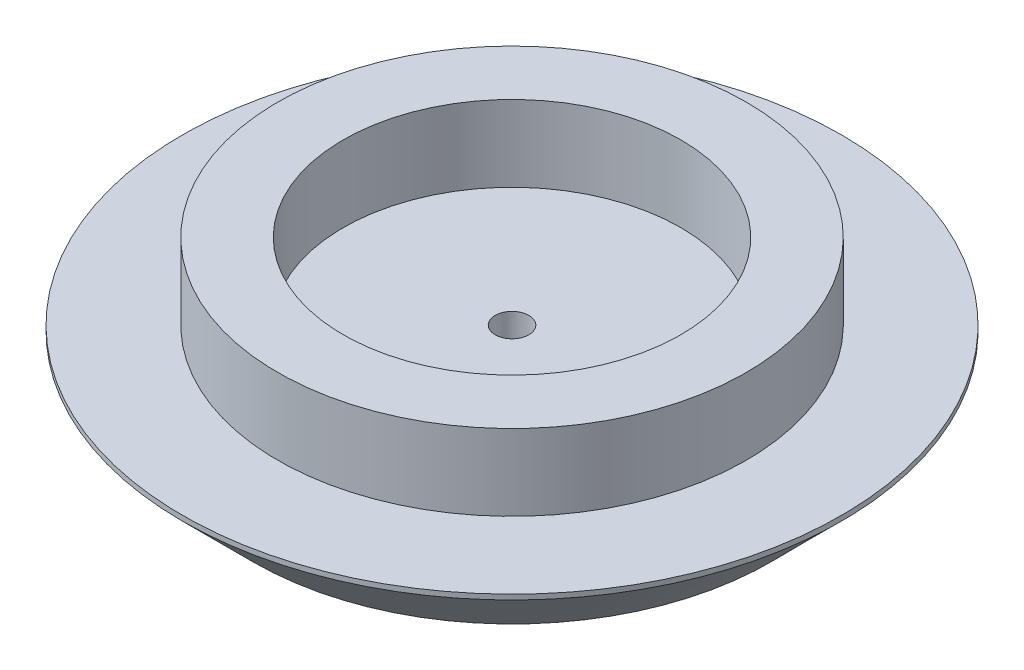
from build123d import *

# Parameters (mm, degrees)
CHAMFER1_SIZE               = 8.89
F_19_0_166_DIAMETER_HOLE1_D = 4.2164


with BuildPart() as part:
    # Sketch1 → Revolve1 (revolve)
    with BuildSketch(Plane.XY, mode=Mode.PRIVATE) as revolve1_sk:
        Polygon((-29.337, 0), (-41.275, 0), (-41.275, -9.525), (0, -9.525), (0, 0), (-21.1455, 0), (-21.1455, 9.525), (-29.337, 9.525), align=None)
    revolve(revolve1_sk.sketch.rotate(Axis((0, -9.525, 0), (0, 1, 0)), 270), axis=Axis((0, -9.525, 0), (0, 1, 0)))

    # Chamfer1
    chamfer1_edges = [part.edges().sort_by_distance(p)[0] for p in [
        (0, -9.525, 41.275),
    ]]
    chamfer(chamfer1_edges, length=CHAMFER1_SIZE)

    # #19 (0.166) Diameter Hole1 (through all)
    with Locations(Plane(origin=(0, -9.525, 0), x_dir=(0, 0, -1), z_dir=(0, -1, 0))):
        with Locations((0, 0)):
            Hole(F_19_0_166_DIAMETER_HOLE1_D / 2)


solid = part.part
